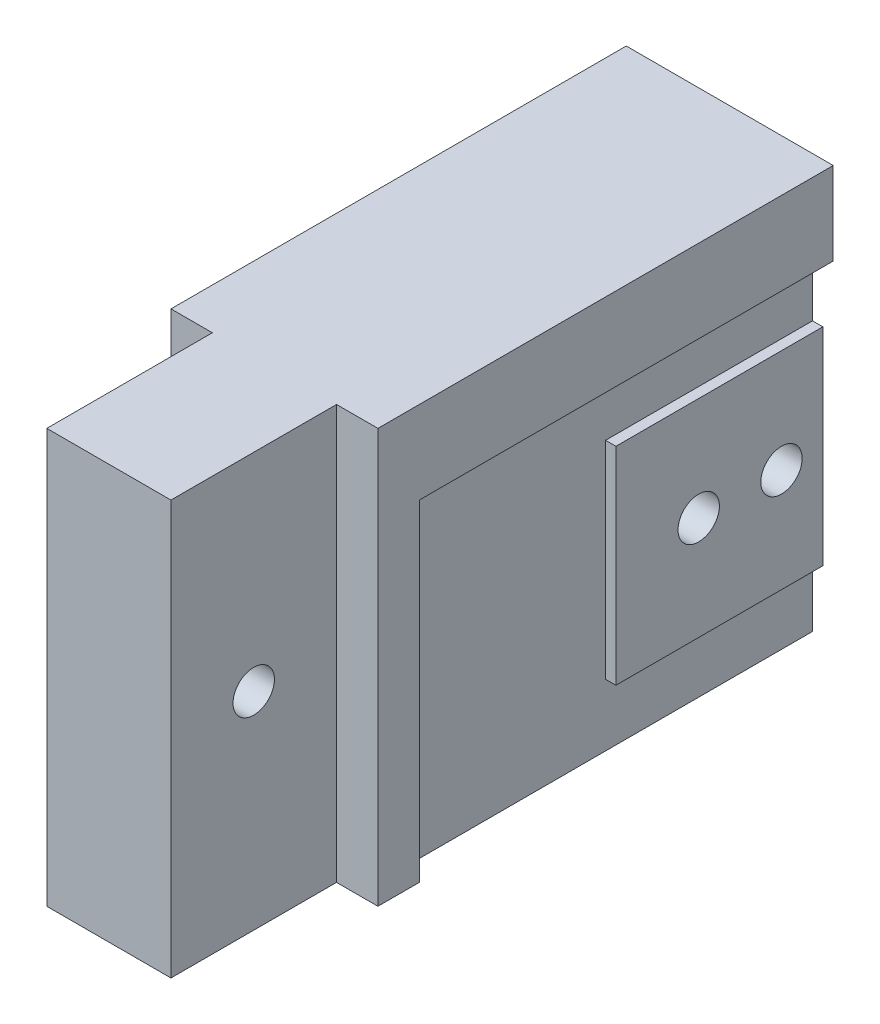
from build123d import *

# Parameters (mm, degrees)
SKIZZE1_W                       = 150
SKIZZE1_H                       = 100
AUFSATZ_LINEAR_AUSTRAGEN1_DEPTH = 50
SKIZZE2_W                       = 100
SKIZZE2_H                       = 80
SCHNITT_LINEAR_AUSTRAGEN1_DEPTH = 5
SKIZZE3_W                       = 50
SKIZZE3_H                       = 50
AUFSATZ_LINEAR_AUSTRAGEN2_DEPTH = 2.5
SKIZZE4_R                       = 5
SCHNITT_LINEAR_AUSTRAGEN2_DEPTH = 10
SKIZZE5_W                       = 10
SKIZZE5_H                       = 100
SCHNITT_LINEAR_AUSTRAGEN3_DEPTH = 40
SKIZZE6_R                       = 5
SCHNITT_LINEAR_AUSTRAGEN4_DEPTH = 40


with BuildPart() as part:
    # Skizze1 → Aufsatz-Linear austragen1 (new body)
    with BuildSketch(Plane(origin=(0, 0, 0), x_dir=(0, 0, -1), z_dir=(1, 0, 0))):
        with Locations((-31.954225352, -9.463028169)):
            Rectangle(SKIZZE1_W, SKIZZE1_H)
    extrude(amount=AUFSATZ_LINEAR_AUSTRAGEN1_DEPTH)

    # Skizze2 → Schnitt-Linear austragen1 (cut)
    with BuildSketch(Plane(origin=(50, 0, 0), x_dir=(0, 0, -1), z_dir=(1, 0, 0))):
        with Locations((-6.954225352, -19.463028169)):
            Rectangle(SKIZZE2_W, SKIZZE2_H)
    extrude(amount=-SCHNITT_LINEAR_AUSTRAGEN1_DEPTH, mode=Mode.SUBTRACT)

    # Skizze3 → Aufsatz-Linear austragen2 (add)
    with BuildSketch(Plane(origin=(45, 0, 0), x_dir=(0, 0, -1), z_dir=(1, 0, 0))):
        with Locations((18.045774648, -19.463028169)):
            Rectangle(SKIZZE3_W, SKIZZE3_H)
    extrude(amount=AUFSATZ_LINEAR_AUSTRAGEN2_DEPTH)

    # Skizze4 → Schnitt-Linear austragen2 (cut)
    with BuildSketch(Plane(origin=(47.5, 0, 0), x_dir=(0, 0, -1), z_dir=(1, 0, 0))):
        with Locations((33.045774648, -19.463028169)):
            Circle(SKIZZE4_R)
        with Locations((13.045774648, -19.463028169)):
            Circle(SKIZZE4_R)
    extrude(amount=-SCHNITT_LINEAR_AUSTRAGEN2_DEPTH, mode=Mode.SUBTRACT)

    # Skizze5 → Schnitt-Linear austragen3 (cut)
    with BuildSketch(Plane.XY.offset(106.954225352)):
        with Locations((5, -9.463028169)):
            Rectangle(SKIZZE5_W, SKIZZE5_H)
        with Locations((45, -9.463028169)):
            Rectangle(SKIZZE5_W, SKIZZE5_H)
    extrude(amount=-SCHNITT_LINEAR_AUSTRAGEN3_DEPTH, mode=Mode.SUBTRACT)

    # Skizze6 → Schnitt-Linear austragen4 (cut)
    with BuildSketch(Plane(origin=(40, 0, 0), x_dir=(0, 0, -1), z_dir=(1, 0, 0))):
        with Locations(Location((-86.954225352, -9.463028169, 0), (0, 0, 90))):
            Circle(SKIZZE6_R)
    extrude(amount=-SCHNITT_LINEAR_AUSTRAGEN4_DEPTH, mode=Mode.SUBTRACT)


solid = part.part
